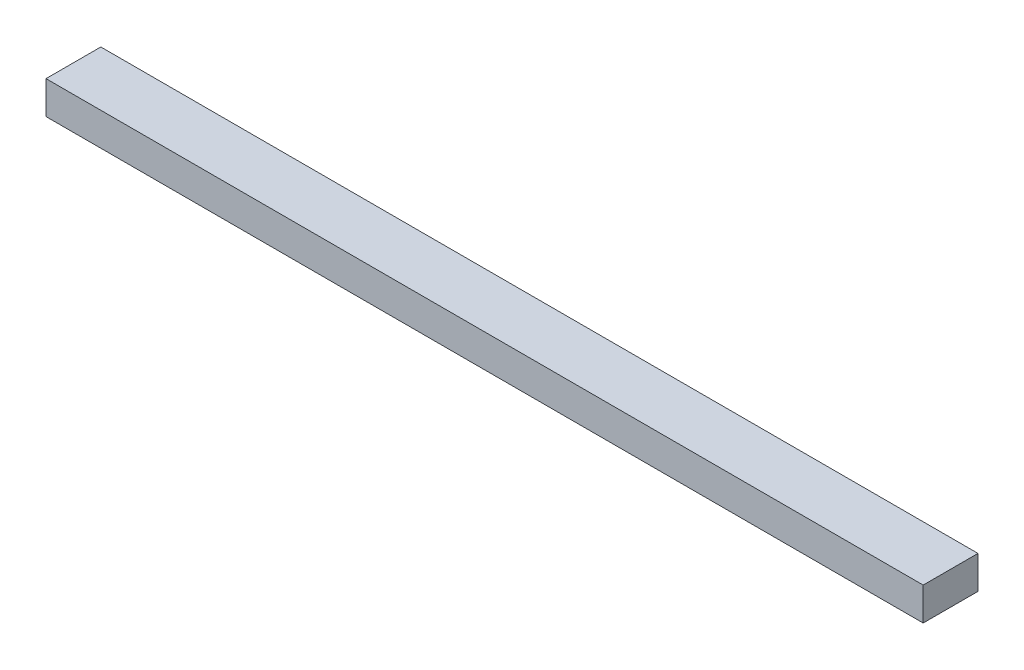
from build123d import *

# Parameters (mm, degrees)
SKETCH2_W           = 160
SKETCH2_H           = 10
BOSS_EXTRUDE1_DEPTH = 6


with BuildPart() as part:
    # Sketch2 → Boss-Extrude1 (new body)
    with BuildSketch(Plane(origin=(0, 0, 0), x_dir=(1, 0, 0), z_dir=(0, 1, 0))):
        Rectangle(SKETCH2_W, SKETCH2_H)
    extrude(amount=BOSS_EXTRUDE1_DEPTH)


solid = part.part
